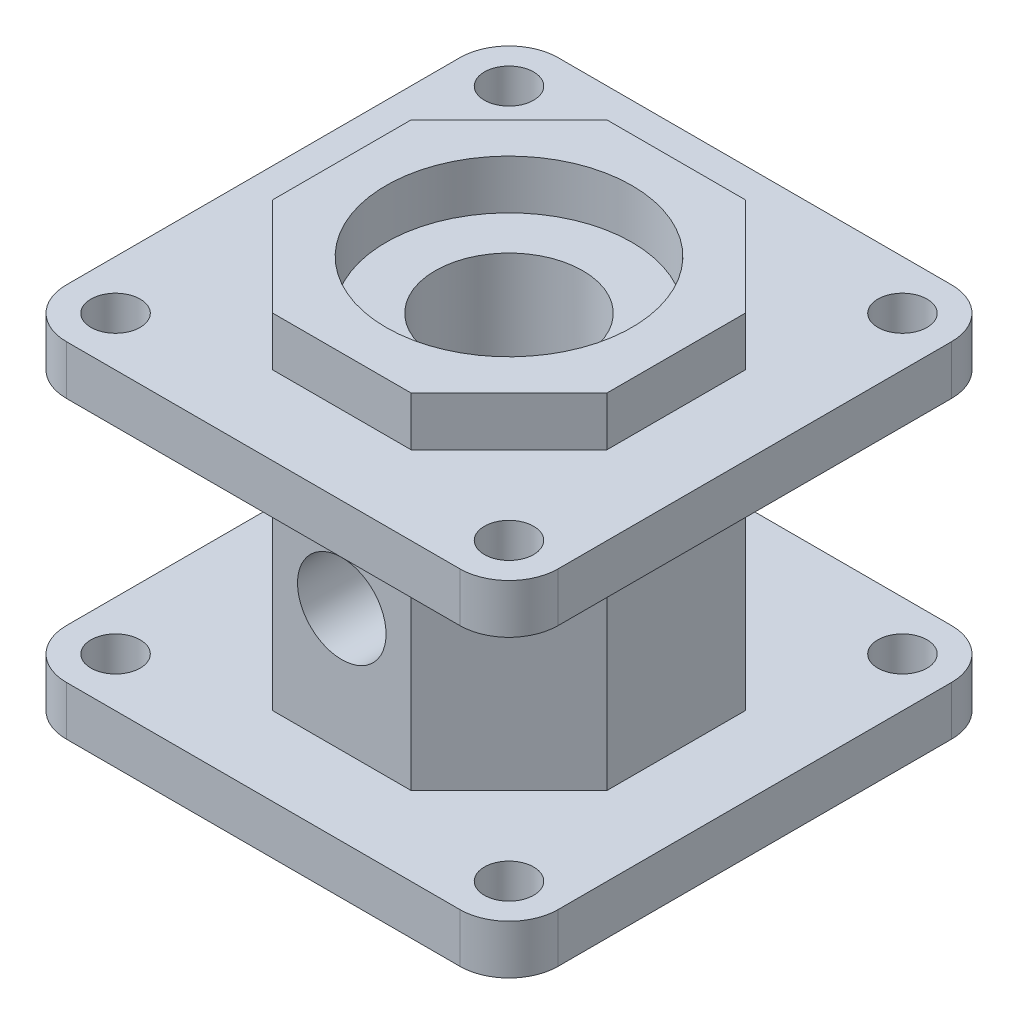
from build123d import *

# Parameters (mm, degrees)
BOSS_EXTRUDE1_DEPTH = 80
SKETCH2_R           = 25
CUT_EXTRUDE1_DEPTH  = 10
SKETCH3_R           = 15
CUT_EXTRUDE2_DEPTH  = 70
SKETCH4_R           = 5
BOSS_EXTRUDE2_DEPTH = 10
SKETCH5_R           = 5
BOSS_EXTRUDE3_DEPTH = 10
SKETCH6_R           = 15
CUT_EXTRUDE3_DEPTH  = 80
SKETCH7_R           = 9
CUT_EXTRUDE4_DEPTH  = 80


with BuildPart() as part:
    # Sketch1 → Boss-Extrude1 (new body)
    with BuildSketch(Plane(origin=(0, 0, 0), x_dir=(1, 0, 0), z_dir=(0, 1, 0))):
        Polygon((34, 14.083261121), (14.083261121, 34), (-14.083261121, 34), (-34, 14.083261121), (-34, -14.083261121), (-14.083261121, -34), (14.083261121, -34), (34, -14.083261121), align=None)
    extrude(amount=BOSS_EXTRUDE1_DEPTH)

    # Sketch2 → Cut-Extrude1 (cut)
    with BuildSketch(Plane(origin=(0, 80, 0), x_dir=(1, 0, 0), z_dir=(0, 1, 0))):
        with Locations(Location((0, 0, 0), (0, 0, 270))):
            Circle(SKETCH2_R)
    extrude(amount=-CUT_EXTRUDE1_DEPTH, mode=Mode.SUBTRACT)

    # Sketch3 → Cut-Extrude2 (cut)
    with BuildSketch(Plane.XZ):
        with Locations(Location((0, 0, 0), (0, 0, 270))):
            Circle(SKETCH3_R)
    extrude(amount=-CUT_EXTRUDE2_DEPTH, mode=Mode.SUBTRACT)

    # Sketch4 → Boss-Extrude2 (add)
    with BuildSketch(Plane.XZ):
        with BuildLine():
            Line((-40, 50), (40, 50))
            ThreePointArc((40, 50), (47.071067812, 47.071067812), (50, 40))
            Line((50, 40), (50, -40))
            ThreePointArc((50, -40), (47.071067812, -47.071067812), (40, -50))
            Line((40, -50), (-40, -50))
            ThreePointArc((-40, -50), (-47.071067812, -47.071067812), (-50, -40))
            Line((-50, -40), (-50, 40))
            ThreePointArc((-50, 40), (-47.071067812, 47.071067812), (-40, 50))
        make_face()
        with Locations(Location((-40, 40, 0), (0, 0, 270))):
            Circle(SKETCH4_R, mode=Mode.SUBTRACT)
        with Locations(Location((40, 40, 0), (0, 0, 270))):
            Circle(SKETCH4_R, mode=Mode.SUBTRACT)
        with Locations(Location((-40, -40, 0), (0, 0, 270))):
            Circle(SKETCH4_R, mode=Mode.SUBTRACT)
        with Locations(Location((40, -40, 0), (0, 0, 270))):
            Circle(SKETCH4_R, mode=Mode.SUBTRACT)
    extrude(amount=-BOSS_EXTRUDE2_DEPTH)

    # Sketch5 → Boss-Extrude3 (add)
    with BuildSketch(Plane(origin=(0, 60, 0), x_dir=(-1, 0, 0), z_dir=(0, -1, 0))):
        with BuildLine():
            Line((-40, 50), (40, 50))
            ThreePointArc((40, 50), (47.071067812, 47.071067812), (50, 40))
            Line((50, 40), (50, -40))
            ThreePointArc((50, -40), (47.071067812, -47.071067812), (40, -50))
            Line((40, -50), (-40, -50))
            ThreePointArc((-40, -50), (-47.071067812, -47.071067812), (-50, -40))
            Line((-50, -40), (-50, 40))
            ThreePointArc((-50, 40), (-47.071067812, 47.071067812), (-40, 50))
        make_face()
        with Locations(Location((-40, 40, 0), (0, 0, 90))):
            Circle(SKETCH5_R, mode=Mode.SUBTRACT)
        with Locations(Location((40, 40, 0), (0, 0, 90))):
            Circle(SKETCH5_R, mode=Mode.SUBTRACT)
        with Locations(Location((-40, -40, 0), (0, 0, 90))):
            Circle(SKETCH5_R, mode=Mode.SUBTRACT)
        with Locations(Location((40, -40, 0), (0, 0, 90))):
            Circle(SKETCH5_R, mode=Mode.SUBTRACT)
    extrude(amount=-BOSS_EXTRUDE3_DEPTH)

    # Sketch6 → Cut-Extrude3 (cut)
    with BuildSketch(Plane.XZ):
        with Locations(Location((0, 0, 0), (0, 0, 270))):
            Circle(SKETCH6_R)
    extrude(amount=-CUT_EXTRUDE3_DEPTH, mode=Mode.SUBTRACT)

    # Sketch7 → Cut-Extrude4 (cut)
    with BuildSketch(Plane.XY.offset(34)):
        with Locations((0, 35)):
            Circle(SKETCH7_R)
    extrude(amount=-CUT_EXTRUDE4_DEPTH, mode=Mode.SUBTRACT)


solid = part.part
